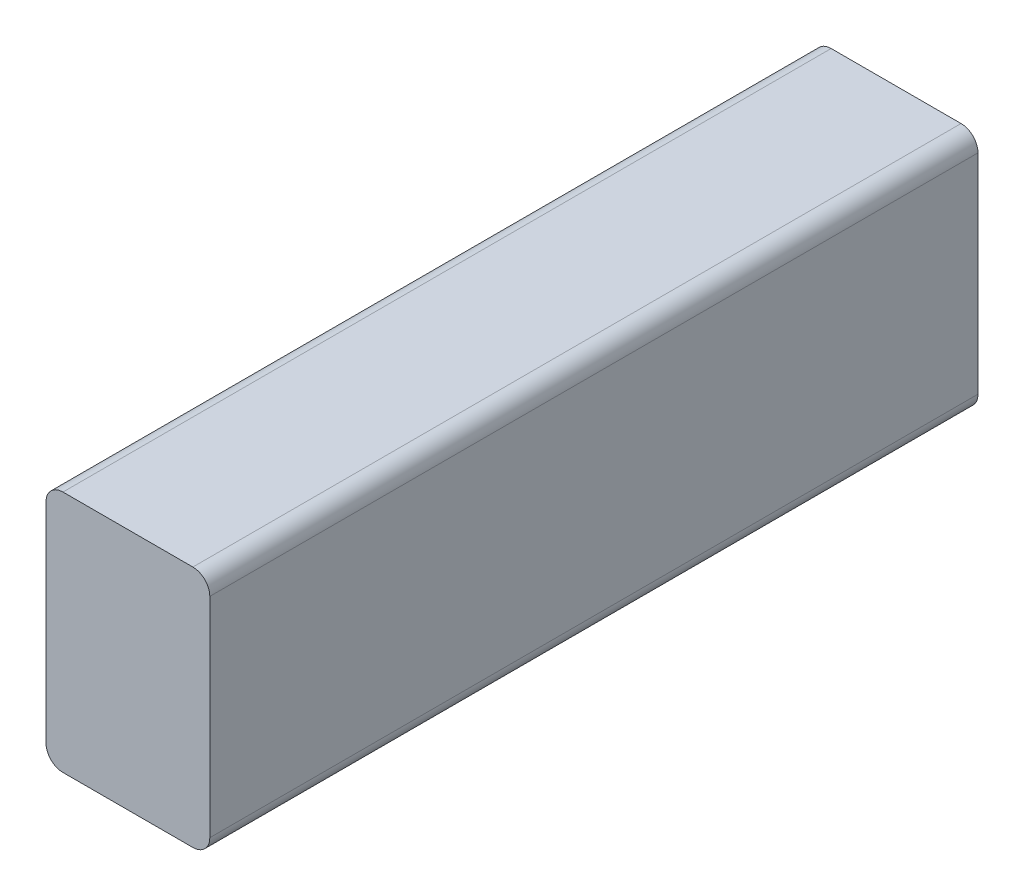
from build123d import *

# Parameters (mm, degrees)
SKETCH_1_W      = 29
SKETCH_1_H      = 43
EXTRUDE_1_DEPTH = 136
FILLET_1_R      = 3


with BuildPart() as part:
    # 草图1 → 凸台-拉伸1 (new body)
    with BuildSketch(Plane.XY):
        Rectangle(SKETCH_1_W, SKETCH_1_H)
    extrude(amount=EXTRUDE_1_DEPTH)

    # 圆角1
    fillet_1_edges = [part.edges().sort_by_distance(p)[0] for p in [
        (14.5, -21.5, 68),
        (-14.5, -21.5, 68),
        (-14.5, 21.5, 68),
        (14.5, 21.5, 68),
    ]]
    fillet(fillet_1_edges, radius=FILLET_1_R)


solid = part.part
